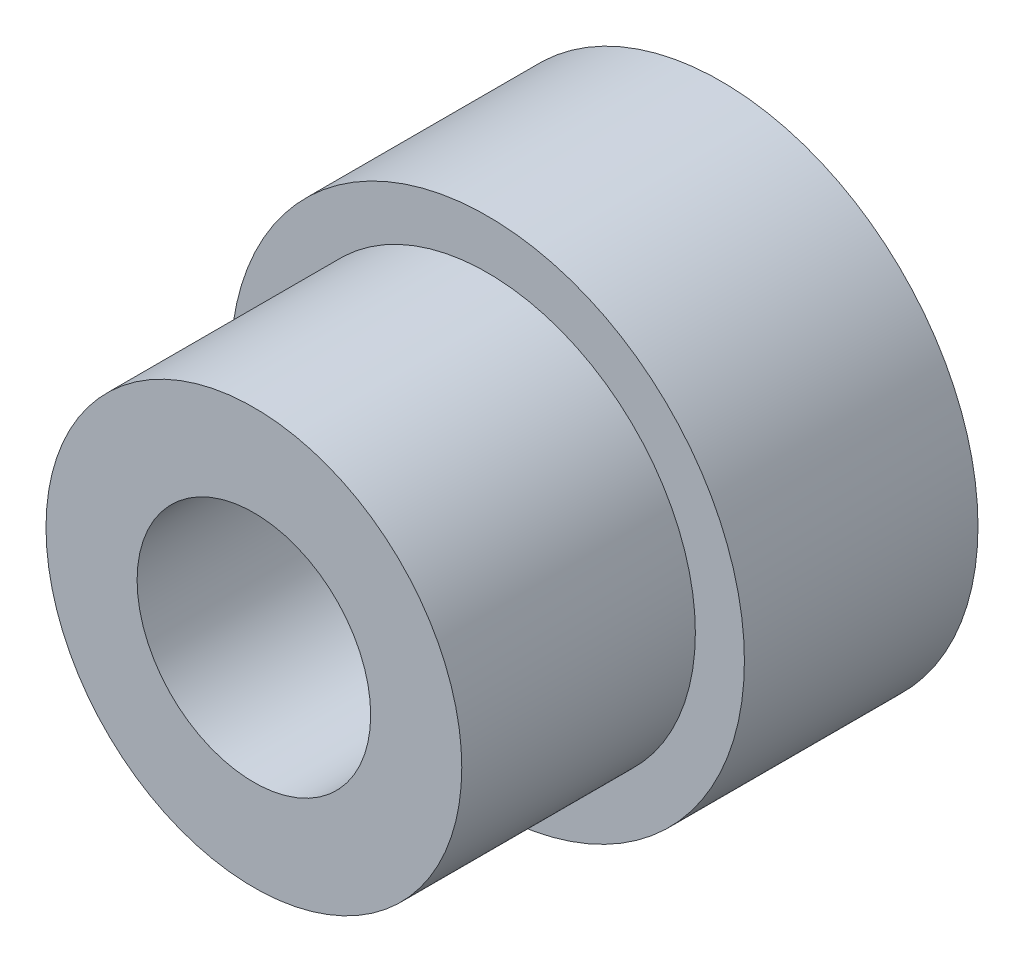
from build123d import *

# Parameters (mm, degrees)
SKETCH_1_R          = 5.5
EXTRUDE_1_DEPTH     = 5
SKETCH_2_R          = 4.45
EXTRUDE_2_DEPTH     = 5
SKETCH_3_R          = 2.5
CUT_EXTRUDE_1_DEPTH = 13.668859459


with BuildPart() as part:
    # 草图1 → 凸台-拉伸1 (new body)
    with BuildSketch(Plane.XY):
        Circle(SKETCH_1_R)
    extrude(amount=EXTRUDE_1_DEPTH)

    # 草图2 → 凸台-拉伸2 (add)
    with BuildSketch(Plane.XY.offset(5)):
        Circle(SKETCH_2_R)
    extrude(amount=EXTRUDE_2_DEPTH)

    # 草图3 → 切除-拉伸1 (cut, through all)
    with BuildSketch(Plane.XY.offset(10)):
        Circle(SKETCH_3_R)
    extrude(amount=-CUT_EXTRUDE_1_DEPTH, mode=Mode.SUBTRACT)


solid = part.part
